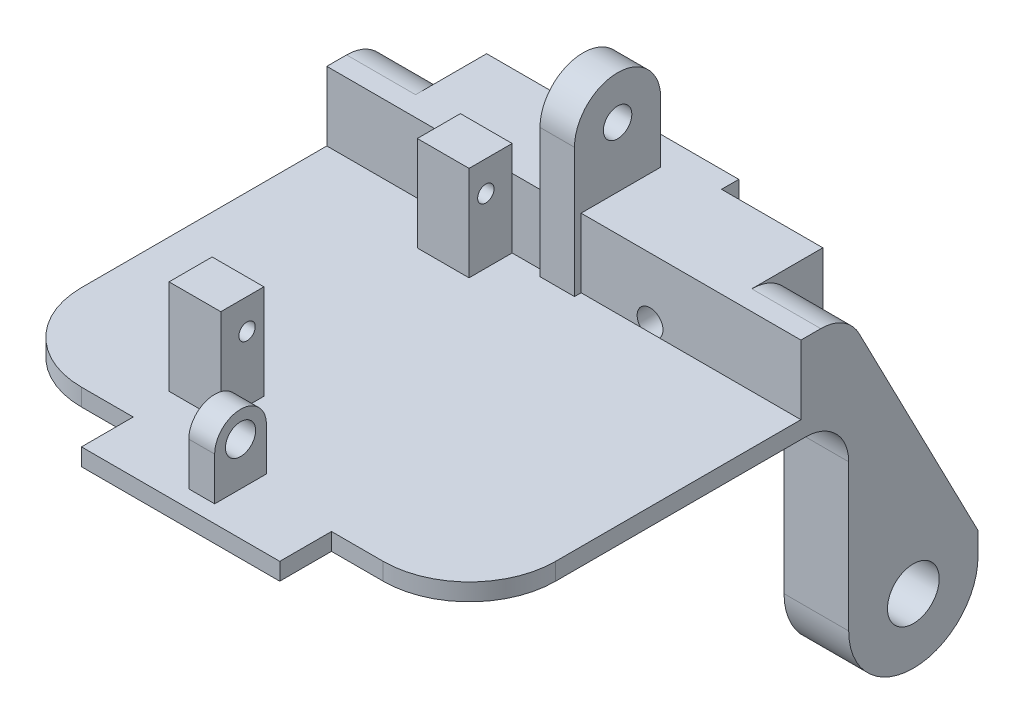
from build123d import *

# Parameters (mm, degrees)
SKETCH_1_W          = 55
SKETCH_1_H          = 39
EXTRUDE_1_DEPTH     = 2
SKETCH_2_W          = 23
SKETCH_2_H          = 6
EXTRUDE_2_DEPTH     = 2
SKETCH_3_W          = 6
SKETCH_3_H          = 5
EXTRUDE_3_DEPTH     = 11
SKETCH_5_R          = 0.95
CUT_EXTRUDE_1_DEPTH = 11
SKETCH_6_W          = 55
SKETCH_6_H          = 0.541458129
EXTRUDE_4_DEPTH     = 8
SKETCH_8_R          = 1.65
EXTRUDE_6_DEPTH     = 2
SKETCH_10_W         = 3
SKETCH_10_H         = 6
EXTRUDE_7_DEPTH     = 8
SKETCH_11_R         = 1.5
CUT_EXTRUDE_3_DEPTH = 13
SKETCH_12_R         = 3
EXTRUDE_8_DEPTH     = 7.5
SKETCH_13_W         = 10
SKETCH_13_H         = 3.7
EXTRUDE_9_DEPTH     = 1
FILLET_3_RADIUS     = 3
FILLET_3_LENGTH     = 3
SKETCH_15_R         = 1.75
CUT_EXTRUDE_5_DEPTH = 23
SKETCH_16_W         = 15.5
SKETCH_16_H         = 4
EXTRUDE_10_DEPTH    = 20
SKETCH_17_R         = 1.5
EXTRUDE_11_DEPTH    = 10
FILLET_4_R          = 10
SKETCH_18_W         = 26.564734734
SKETCH_18_H         = 10.454508508
CUT_EXTRUDE_6_DEPTH = 10
CUT_EXTRUDE_7_DEPTH = 8
CUT_EXTRUDE_8_DEPTH = 8
FILLET_6_R          = 5
SKETCH_21_R         = 1.4
CUT_EXTRUDE_9_DEPTH = 4
FILLET_7_R          = 10


with BuildPart() as part:
    # 草图1 → 凸台-拉伸1 (new body)
    with BuildSketch(Plane(origin=(0, 0, 0), x_dir=(1, 0, 0), z_dir=(0, 1, 0))):
        Rectangle(SKETCH_1_W, SKETCH_1_H)
    extrude(amount=EXTRUDE_1_DEPTH)

    # 草图2 → 凸台-拉伸2 (add)
    with BuildSketch(Plane(origin=(0, 2, 0), x_dir=(1, 0, 0), z_dir=(0, 1, 0))):
        with Locations((0, -22.5)):
            Rectangle(SKETCH_2_W, SKETCH_2_H)
    extrude(amount=-EXTRUDE_2_DEPTH)

    # 草图3 → 凸台-拉伸3 (add)
    with BuildSketch(Plane(origin=(0, 2, 0), x_dir=(1, 0, 0), z_dir=(0, 1, 0))):
        with Locations((-9, -12.341458129)):
            Rectangle(SKETCH_3_W, SKETCH_3_H)
        with Locations((-9, 16.458541871)):
            Rectangle(SKETCH_3_W, SKETCH_3_H)
    extrude(amount=EXTRUDE_3_DEPTH)

    # 草图5 → 切除-拉伸1 (cut)
    with BuildSketch(Plane.ZY.offset(12)):
        with Locations((-15.908541871, 9.5)):
            Circle(SKETCH_5_R)
        with Locations((11.791458129, 9.5)):
            Circle(SKETCH_5_R)
    extrude(amount=-CUT_EXTRUDE_1_DEPTH, mode=Mode.SUBTRACT)

    # 草图6 → 凸台-拉伸4 (add)
    with BuildSketch(Plane(origin=(0, 2, 0), x_dir=(1, 0, 0), z_dir=(0, 1, 0))):
        with Locations((0, 19.229270936)):
            Rectangle(SKETCH_6_W, SKETCH_6_H)
    extrude(amount=EXTRUDE_4_DEPTH)

    # 草图8 → 凸台-拉伸6 (add, symmetric)
    with BuildSketch(Plane(origin=(0, 0, 0), x_dir=(0, 0, -1), z_dir=(1, 0, 0))):
        with BuildLine():
            Line((28.189872998, 17), (28.189872998, 0))
            Line((28.189872998, 0), (18.189872998, 0))
            Line((18.189872998, 0), (18.189872998, 17))
            ThreePointArc((18.189872998, 17), (23.189872998, 22), (28.189872998, 17))
        make_face()
        with Locations((23.189872998, 17)):
            Circle(SKETCH_8_R, mode=Mode.SUBTRACT)
    extrude(amount=EXTRUDE_6_DEPTH, both=True)

    # 草图10 → 凸台-拉伸7 (add)
    with BuildSketch(Plane(origin=(0, 2, 0), x_dir=(1, 0, 0), z_dir=(0, 1, 0))):
        with Locations((0.45, -20.5)):
            Rectangle(SKETCH_10_W, SKETCH_10_H)
    extrude(amount=EXTRUDE_7_DEPTH)

    # 草图11 → 切除-拉伸3 (cut)
    with BuildSketch(Plane.XY.offset(-18.958541871)):
        with Locations((-10, 3)):
            Circle(SKETCH_11_R)
    cut_extrude_3 = extrude(amount=-CUT_EXTRUDE_3_DEPTH, mode=Mode.SUBTRACT)

    # 草图12 → 凸台-拉伸8 (add)
    with BuildSketch(Plane.ZY.offset(27.5)):
        with BuildLine():
            Line((-39.5, -22), (-39.5, 10))
            Line((-39.5, 10), (-19.5, 10))
            Line((-19.5, 10), (-19.5, 0))
            Line((-19.5, 0), (-24.5, 0))
            Line((-24.5, 0), (-24.5, -22))
            ThreePointArc((-24.5, -22), (-32, -29.5), (-39.5, -22))
        make_face()
        with Locations((-32, -22)):
            Circle(SKETCH_12_R, mode=Mode.SUBTRACT)
    extrude_8 = extrude(amount=-EXTRUDE_8_DEPTH)

    # 草图13 → 凸台-拉伸9 (add)
    with BuildSketch(Plane.XZ):
        with Locations((0, 19.15)):
            Rectangle(SKETCH_13_W, SKETCH_13_H)
    extrude(amount=EXTRUDE_9_DEPTH)

    # 镜向1: 切除-拉伸3, 凸台-拉伸8 across plane
    add(cut_extrude_3.mirror(Plane(origin=(0, 0, 0), x_dir=(0, 0, 1), z_dir=(1, 0, 0))), mode=Mode.SUBTRACT)
    add(extrude_8.mirror(Plane(origin=(0, 0, 0), x_dir=(0, 0, 1), z_dir=(1, 0, 0))))

    # 圆角3: full round fillet: the end face becomes a half cylinder, R = half its width
    fillet_3_face = Plane((0.45, 10, 20.5), x_dir=(1, 0, 0), z_dir=(0, 1, 0))  # on the end face: x along it, z out of the body
    fillet_3_slab = fillet_3_face.offset(-FILLET_3_RADIUS / 2) * Box(FILLET_3_LENGTH, 2 * FILLET_3_RADIUS, FILLET_3_RADIUS, mode=Mode.PRIVATE)  # the body's end, R deep
    fillet_3_round = Plane((0.45, 7, 20.5), x_dir=(0, 1, 0), z_dir=(1, 0, 0)) * Cylinder(FILLET_3_RADIUS, FILLET_3_LENGTH, mode=Mode.PRIVATE)  # its axis R under the face
    add(fillet_3_slab - fillet_3_round, mode=Mode.SUBTRACT)

    # 草图15 → 切除-拉伸5 (cut)
    with BuildSketch(Plane.ZY.offset(1.05)):
        with Locations((20.5, 7)):
            Circle(SKETCH_15_R)
    extrude(amount=-CUT_EXTRUDE_5_DEPTH, mode=Mode.SUBTRACT)

    # 草图16 → 凸台-拉伸10 (add)
    with BuildSketch(Plane(origin=(0, 0, -19.5), x_dir=(-1, 0, 0), z_dir=(0, 0, -1))):
        with Locations((0, 8)):
            Rectangle(SKETCH_16_W, SKETCH_16_H)
    extrude(amount=EXTRUDE_10_DEPTH)

    # 草图17 → 凸台-拉伸11 (add)
    # profile 1 of 2: a face of its own
    with BuildSketch(Plane(origin=(0, 0, -19.5), x_dir=(-1, 0, 0), z_dir=(0, 0, -1))):
        Polygon((-20, 0), (-2, 0), (-2, 6), (-7.75, 6), (-7.75, 10), (-20, 10), align=None)
        with Locations(Location((-10, 3, 0), (0, 0, 221.810314896))):
            Circle(SKETCH_17_R, mode=Mode.SUBTRACT)
    # profile 2 of 2: a face of its own
    with BuildSketch(Plane(origin=(0, 0, -19.5), x_dir=(-1, 0, 0), z_dir=(0, 0, -1))):
        Polygon((7.75, 6), (2, 6), (2, 0), (20, 0), (20, 10), (7.75, 10), align=None)
        with Locations(Location((10, 3, 0), (0, 0, 180))):
            Circle(SKETCH_17_R, mode=Mode.SUBTRACT)
    extrude(amount=EXTRUDE_11_DEPTH)

    # 圆角4
    fillet_4_edges = [part.edges().sort_by_distance(p)[0] for p in [
        (23.75, 10, -39.5),
        (-23.75, 10, -39.5),
    ]]
    fillet(fillet_4_edges, radius=FILLET_4_R)

    # 草图18 → 切除-拉伸6 (cut)
    with BuildSketch(Plane(origin=(0, 10, 0), x_dir=(1, 0, 0), z_dir=(0, 1, 0))):
        with Locations((-0.840887807, 36.727254254)):
            Rectangle(SKETCH_18_W, SKETCH_18_H)
    extrude(amount=-CUT_EXTRUDE_6_DEPTH, mode=Mode.SUBTRACT)

    # 草图19 → 切除-拉伸7 (cut)
    with BuildSketch(Plane(origin=(27.5, 0, 0), x_dir=(0, 0, -1), z_dir=(1, 0, 0))):
        Polygon((24.3, 10), (39.5, -19.395601839), (39.5, 10), align=None)
    extrude(amount=-CUT_EXTRUDE_7_DEPTH, mode=Mode.SUBTRACT)

    # 草图20 → 切除-拉伸8 (cut)
    with BuildSketch(Plane.ZY.offset(27.5)):
        Polygon((-24.3, 10), (-39.5, 10), (-39.5, -19.395601839), align=None)
    extrude(amount=-CUT_EXTRUDE_8_DEPTH, mode=Mode.SUBTRACT)

    # 圆角6
    fillet_6_edges = [part.edges().sort_by_distance(p)[0] for p in [
        (-23.75, 0, -24.5),
        (23.75, 0, -24.5),
        (23.5, 10, -24.3),
        (-23.5, 10, -24.3),
    ]]
    fillet(fillet_6_edges, radius=FILLET_6_R)

    # 草图21 → 切除-拉伸9 (cut)
    with BuildSketch(Plane.XZ.offset(1)):
        with Locations(Location((0, 19.15, 0), (0, 0, 270))):
            Circle(SKETCH_21_R)
    extrude(amount=-CUT_EXTRUDE_9_DEPTH, mode=Mode.SUBTRACT)

    # 圆角7
    fillet_7_edges = [part.edges().sort_by_distance(p)[0] for p in [
        (27.5, 1, 19.5),
        (-27.5, 1, 19.5),
    ]]
    fillet(fillet_7_edges, radius=FILLET_7_R)


solid = part.part
